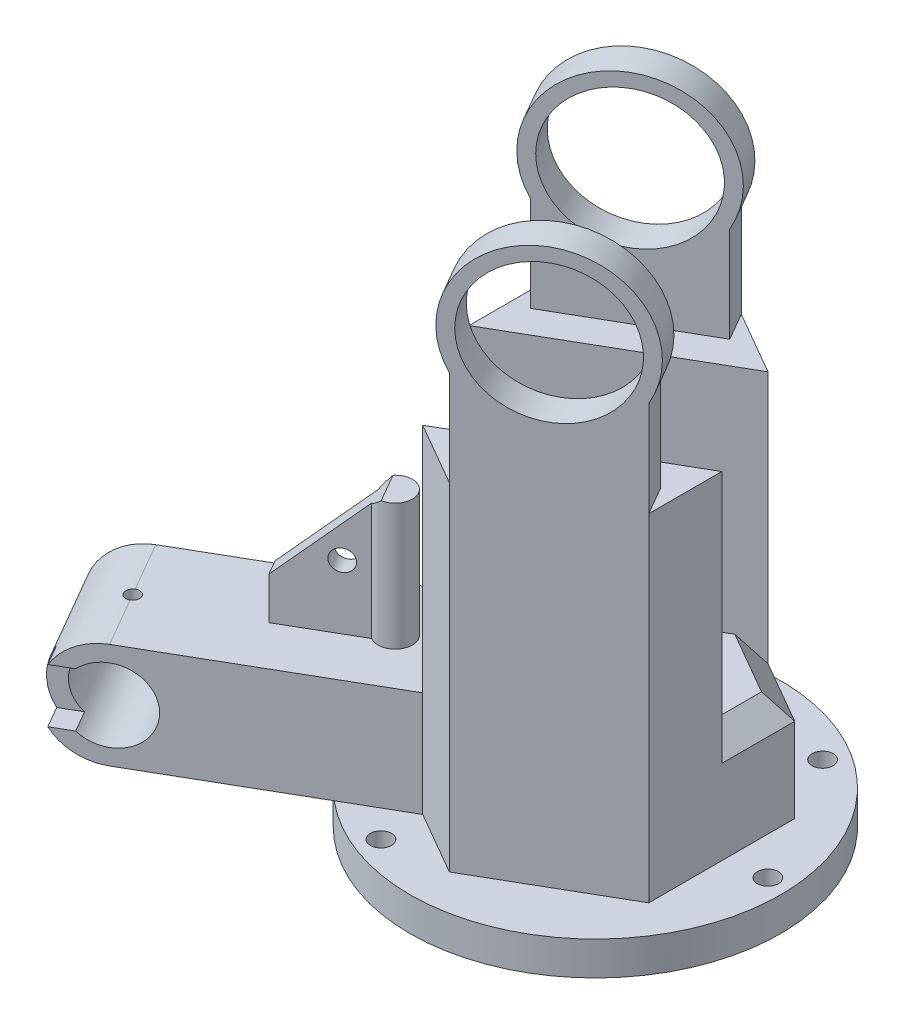
from build123d import *

# Parameters (mm, degrees)
SKETCH4_R            = 55.88
BOSS_EXTRUDE2_DEPTH  = 10.16
BOSS_EXTRUDE4_DEPTH  = 101.6
BOSS_EXTRUDE5_DEPTH  = 9.525
BOSS_EXTRUDE6_START  = -9.525
BOSS_EXTRUDE6_DEPTH  = 9.525
CUT_EXTRUDE4_REACH   = 214.095
SKETCH12_R           = 20.828
SKETCH13_W           = 38.1
SKETCH13_H           = 69.85
CUT_EXTRUDE5_DEPTH   = 76.2
BOSS_EXTRUDE10_DEPTH = 19.05
SKETCH28_R           = 11.049
CUT_EXTRUDE9_DEPTH   = 38.1
CUT_EXTRUDE10_DEPTH  = 7.366
CHAMFER1_SIZE        = 6.35
SKETCH30_R           = 2.1
CUT_EXTRUDE11_DEPTH  = 7.366
SKETCH31_R           = 3.175
CUT_EXTRUDE12_DEPTH  = 215.41878972
BOSS_EXTRUDE11_DEPTH = 38.1
CHAMFER2_SIZE        = 25.4
CUT_EXTRUDE13_REACH  = 224.549
SKETCH34_R           = 3.175


with BuildPart() as part:
    # Sketch4 → Boss-Extrude2 (new body)
    with BuildSketch(Plane(origin=(0, 0, 0), x_dir=(1, 0, 0), z_dir=(0, 1, 0))):
        with Locations(Location((0, 0, 0), (0, 0, 270))):
            Circle(SKETCH4_R)
    extrude(amount=BOSS_EXTRUDE2_DEPTH)

    # Sketch8 → Boss-Extrude4 (add)
    with BuildSketch(Plane(origin=(0, 10.16, 0), x_dir=(1, 0, 0), z_dir=(0, 1, 0))):
        Polygon((0, 43.994090512), (-38.1, 21.997045256), (-38.1, -21.997045256), (0, -43.994090512), (38.1, -21.997045256), (38.1, 21.997045256), align=None)
    extrude(amount=BOSS_EXTRUDE4_DEPTH)

    # Sketch9 → Boss-Extrude5 (add)
    with BuildSketch(Plane(origin=(-19.05, 0, -32.995567884), x_dir=(-0.8660254037844386, 0, 0.5000000000000003), z_dir=(-0.5000000000000002, 0, -0.8660254037844385))):
        with BuildLine():
            Line((21.997045256, 111.76), (-21.997045256, 111.76))
            Line((-21.997045256, 111.76), (-21.997045256, 140.520185187))
            ThreePointArc((-21.997045256, 140.520185187), (0, 177.4), (21.997045256, 140.520185187))
            Line((21.997045256, 140.520185187), (21.997045256, 111.76))
        make_face()
    extrude(amount=-BOSS_EXTRUDE5_DEPTH)

    # Sketch10 → Boss-Extrude6 (add)
    with BuildSketch(Plane(origin=(19.05, 0, 32.995567884), x_dir=(0.8660254037844386, 0, -0.5000000000000001), z_dir=(0.5000000000000001, 0, 0.8660254037844386)).offset(BOSS_EXTRUDE6_START)):
        with BuildLine():
            Line((-21.997045256, 111.76), (21.997045256, 111.76))
            Line((21.997045256, 111.76), (21.997045256, 140.520185187))
            ThreePointArc((21.997045256, 140.520185187), (0, 177.4), (-21.997045256, 140.520185187))
            Line((-21.997045256, 140.520185187), (-21.997045256, 111.76))
        make_face()
    extrude(amount=BOSS_EXTRUDE6_DEPTH)

    # Cut-Extrude4: up to this face of the body (flat: up to its plane)
    cut_extrude4_end = Plane(part.part.faces().sort_by_distance((19.05, 92.730612225, 32.995567884))[0])
    # Sketch12 → Cut-Extrude4 (cut, up to the picked face)
    with BuildSketch(Plane(origin=(-19.05, 0, -32.995567884), x_dir=(-0.8660254037844386, 0, 0.5000000000000003), z_dir=(-0.5000000000000002, 0, -0.8660254037844385)), mode=Mode.PRIVATE) as cut_extrude4_sk1:
        with Locations((0, 152.4)):
            Circle(SKETCH12_R)
    cut_extrude4_tool1 = split(extrude(cut_extrude4_sk1.sketch, amount=-CUT_EXTRUDE4_REACH, mode=Mode.PRIVATE), bisect_by=cut_extrude4_end, keep=Keep.BOTH, mode=Mode.PRIVATE)
    add(cut_extrude4_tool1.solids().sort_by(Axis((-19.05, 152.4, -32.995568), (0.5000000000000002, 0, 0.8660254037844385)))[0], mode=Mode.SUBTRACT)

    # Sketch13 → Cut-Extrude5 (cut, symmetric)
    with BuildSketch(Plane(origin=(-19.05, 0, 10.998522628), x_dir=(0.5000000000000002, 0, 0.8660254037844386), z_dir=(-0.8660254037844385, 0, 0.5000000000000001))):
        with Locations((0, 76.835)):
            Rectangle(SKETCH13_W, SKETCH13_H)
    extrude(amount=CUT_EXTRUDE5_DEPTH, both=True, mode=Mode.SUBTRACT)

    # Sketch22 → Boss-Extrude10 (add, symmetric)
    with BuildSketch(Plane(origin=(0, 0, 0), x_dir=(-0.8660254037844386, 0, 0.5000000000000001), z_dir=(-0.5000000000000001, 0, -0.8660254037844386))):
        with BuildLine():
            Line((43.994090512, 41.91), (102.10102108, 41.91))
            ThreePointArc((102.10102108, 41.91), (117.97602108, 26.035), (102.10102108, 10.16))
            Line((102.10102108, 10.16), (43.994090512, 10.16))
            Line((43.994090512, 10.16), (21.997045256, 10.16))
            Line((21.997045256, 10.16), (21.997045256, 41.91))
            Line((21.997045256, 41.91), (43.994090512, 41.91))
        make_face()
    extrude(amount=BOSS_EXTRUDE10_DEPTH, both=True)

    # Sketch28 → Cut-Extrude9 (cut)
    with BuildSketch(Plane(origin=(9.525, 0, 16.497783942), x_dir=(0.8660254037844386, 0, -0.5000000000000001), z_dir=(0.5000000000000001, 0, 0.8660254037844386))):
        with Locations((-102.10102108, 26.035)):
            Circle(SKETCH28_R)
    extrude(amount=-CUT_EXTRUDE9_DEPTH, mode=Mode.SUBTRACT)

    # Sketch29 → Cut-Extrude10 (cut)
    with BuildSketch(Plane(origin=(9.525, 0, 16.497783942), x_dir=(0.8660254037844386, 0, -0.5000000000000001), z_dir=(0.5000000000000001, 0, 0.8660254037844386))):
        with BuildLine():
            Line((-115.737415068, 17.907), (-109.585405958, 17.907))
            ThreePointArc((-109.585405958, 17.907), (-113.15002108, 26.035), (-109.585405958, 34.163))
            Line((-109.585405958, 34.163), (-115.737415068, 34.163))
            ThreePointArc((-115.737415068, 34.163), (-117.97602108, 26.035), (-115.737415068, 17.907))
        make_face()
    extrude(amount=-CUT_EXTRUDE10_DEPTH, mode=Mode.SUBTRACT)

    # Chamfer1
    chamfer1_edges = [part.edges().sort_by_distance(p)[0] for p in [
        (38.1, 41.91, -10.998522628),
        (28.575, 41.91, -27.49630657),
    ]]
    chamfer(chamfer1_edges, length=CHAMFER1_SIZE)

    # Sketch30 → Cut-Extrude11 (cut)
    with BuildSketch(Plane(origin=(0, 41.91, 0), x_dir=(1, 0, 0), z_dir=(0, 1, 0))):
        with Locations(Location((-88.422078008, -51.05051054, 0), (0, 0, 270))):
            Circle(SKETCH30_R)
    extrude(amount=-CUT_EXTRUDE11_DEPTH, mode=Mode.SUBTRACT)

    # Sketch31 → Cut-Extrude12 (cut, through all)
    with BuildSketch(Plane(origin=(0, 10.16, 0), x_dir=(1, 0, 0), z_dir=(0, 1, 0))):
        with Locations(Location((-49.089000823, 6.594762938, 0), (0, 0, 270))):
            Circle(SKETCH31_R)
        with Locations(Location((26.925278647, 41.57222955, 0), (0, 0, 270))):
            Circle(SKETCH31_R)
    cut_extrude12 = extrude(amount=-CUT_EXTRUDE12_DEPTH, mode=Mode.SUBTRACT)

    # Mirror1: Cut-Extrude12 across plane
    add(cut_extrude12.mirror(Plane(origin=(0, 0, 0), x_dir=(-0.8660254037844386, 0, 0.5000000000000001), z_dir=(-0.5000000000000001, 0, -0.8660254037844386))), mode=Mode.SUBTRACT)

    # Sketch33 → Boss-Extrude11 (add)
    with BuildSketch(Plane(origin=(0, 41.91, 0), x_dir=(1, 0, 0), z_dir=(0, 1, 0))):
        with BuildLine():
            Line((-43.411916389, -22.079834386), (-63.092428819, -33.442383535))
            Line((-63.092428819, -33.442383535), (-61.800298466, -35.680418955))
            Line((-61.800298466, -35.680418955), (-60.542722832, -37.858603849))
            Line((-60.542722832, -37.858603849), (-40.91541904, -26.504074545))
            ThreePointArc((-40.91541904, -26.504074545), (-33.742060338, -19.539834386), (-43.411916389, -22.079834386))
        make_face()
    extrude(amount=BOSS_EXTRUDE11_DEPTH)

    # Chamfer2
    chamfer2_edges = [part.edges().sort_by_distance(p)[0] for p in [
        (-61.817575825, 80.01, 35.650493692),
    ]]
    chamfer(chamfer2_edges, length=CHAMFER2_SIZE)

    # Cut-Extrude13: up to this plane
    cut_extrude13_end = Plane(origin=(-60.542722832, 80.01, 37.858603849), z_dir=(-0.500750644235671, 0, -0.8655915851587056))
    # Sketch34 → Cut-Extrude13 (cut, up to the surface)
    with BuildSketch(Plane(origin=(-1.292130352, 0, -2.23803542), x_dir=(-0.8660254037844386, 0, 0.5000000000000003), z_dir=(-0.5000000000000002, 0, -0.8660254037844385)), mode=Mode.PRIVATE) as cut_extrude13_sk1:
        with Locations((55.184849848, 61.159110234)):
            Circle(SKETCH34_R)
    cut_extrude13_tool1 = split(extrude(cut_extrude13_sk1.sketch, amount=-CUT_EXTRUDE13_REACH, mode=Mode.PRIVATE), bisect_by=cut_extrude13_end, keep=Keep.BOTH, mode=Mode.PRIVATE)
    add(cut_extrude13_tool1.solids().sort_by_distance((-49.083612, 61.15911, 25.35439))[0], mode=Mode.SUBTRACT)


solid = part.part
